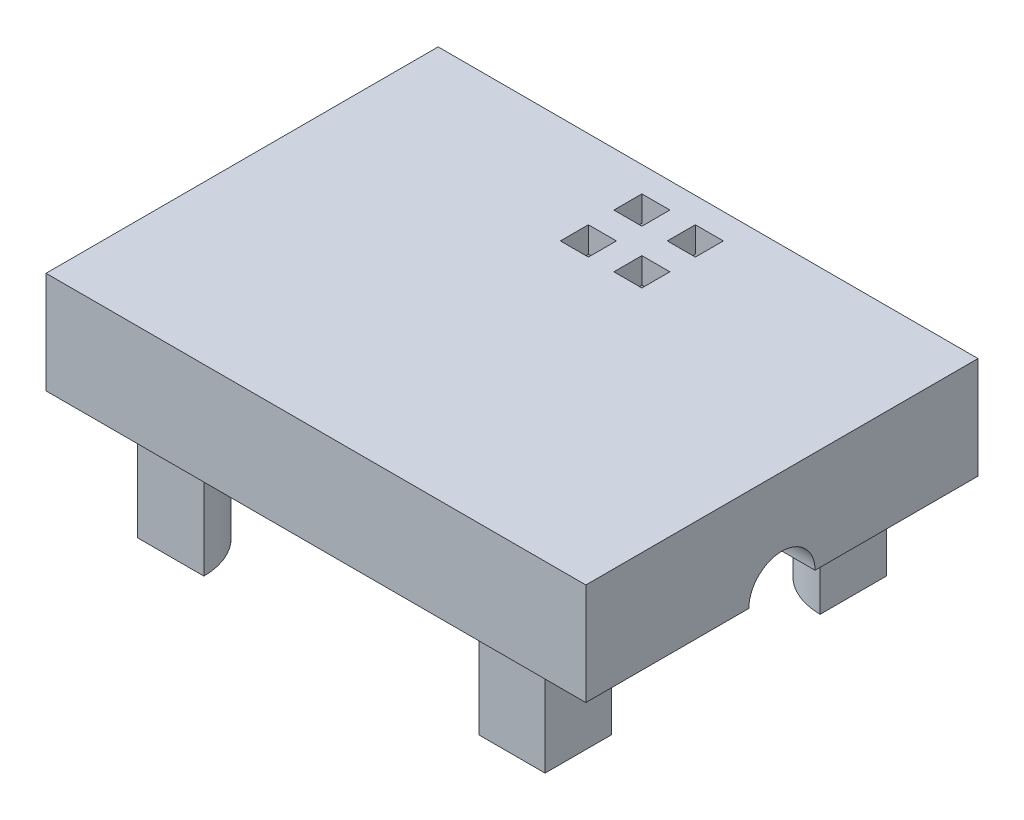
from build123d import *

# Parameters (mm, degrees)
CROQUIS1_W              = 42.4
CROQUIS1_H              = 30.8
CROQUIS1_W_2            = 32
CROQUIS1_H_2            = 26.8
SALIENTE_EXTRUIR1_DEPTH = 6
SALIENTE_EXTRUIR2_DEPTH = 14.4
SALIENTE_EXTRUIR3_START = 2
CROQUIS1_4_W            = 42.4
CROQUIS1_4_H            = 30.8
CROQUIS1_4_W_2          = 32
CROQUIS1_4_H_2          = 26.8
CROQUIS1_4_W_3          = 2.2
CROQUIS1_4_H_3          = 2.2
SALIENTE_EXTRUIR3_DEPTH = 2
CORTAR_EXTRUIR1_REACH   = 49.353


with BuildPart() as part:
    # Croquis1 → Saliente-Extruir1 (new body)
    with BuildSketch(Plane(origin=(0, 0, 0), x_dir=(1, 0, 0), z_dir=(0, 1, 0))):
        Rectangle(CROQUIS1_W, CROQUIS1_H)
        Rectangle(CROQUIS1_W_2, CROQUIS1_H_2, mode=Mode.SUBTRACT)
    extrude(amount=-SALIENTE_EXTRUIR1_DEPTH)

    # Croquis1<3> → Saliente-Extruir2 (add)
    with BuildSketch(Plane(origin=(0, 0, 0), x_dir=(1, 0, 0), z_dir=(0, 1, 0))):
        with BuildLine():
            Line((-16, 13.4), (-16, 8.2))
            ThreePointArc((-16, 8.2), (-12.323044738, 9.723044738), (-10.8, 13.4))
            Line((-10.8, 13.4), (-16, 13.4))
        make_face()
        with BuildLine():
            Line((-16, -8.2), (-16, -13.4))
            Line((-16, -13.4), (-10.8, -13.4))
            ThreePointArc((-10.8, -13.4), (-12.323044738, -9.723044738), (-16, -8.2))
        make_face()
        with BuildLine():
            ThreePointArc((10.8, 13.4), (12.323044738, 9.723044738), (16, 8.2))
            Line((16, 8.2), (16, 13.4))
            Line((16, 13.4), (10.8, 13.4))
        make_face()
        with BuildLine():
            ThreePointArc((16, -8.2), (12.323044738, -9.723044738), (10.8, -13.4))
            Line((10.8, -13.4), (16, -13.4))
            Line((16, -13.4), (16, -8.2))
        make_face()
    extrude(amount=-SALIENTE_EXTRUIR2_DEPTH)

    # Croquis1<4> → Saliente-Extruir3 (add)
    # profile 1 of 6: a face of its own
    with BuildSketch(Plane(origin=(0, 0, 0), x_dir=(1, 0, 0), z_dir=(0, 1, 0)).offset(SALIENTE_EXTRUIR3_START)):
        Rectangle(CROQUIS1_4_W, CROQUIS1_4_H)
        Rectangle(CROQUIS1_4_W_2, CROQUIS1_4_H_2, mode=Mode.SUBTRACT)
    # profile 2 of 6: a face of its own
    with BuildSketch(Plane(origin=(0, 0, 0), x_dir=(1, 0, 0), z_dir=(0, 1, 0)).offset(SALIENTE_EXTRUIR3_START)):
        with BuildLine():
            Line((-16, -8.2), (-16, -13.4))
            Line((-16, -13.4), (-10.8, -13.4))
            ThreePointArc((-10.8, -13.4), (-12.323044738, -9.723044738), (-16, -8.2))
        make_face()
    # profile 3 of 6: a face of its own
    with BuildSketch(Plane(origin=(0, 0, 0), x_dir=(1, 0, 0), z_dir=(0, 1, 0)).offset(SALIENTE_EXTRUIR3_START)):
        with BuildLine():
            ThreePointArc((16, -8.2), (12.323044738, -9.723044738), (10.8, -13.4))
            Line((10.8, -13.4), (16, -13.4))
            Line((16, -13.4), (16, -8.2))
        make_face()
    # profile 4 of 6: a face of its own
    with BuildSketch(Plane(origin=(0, 0, 0), x_dir=(1, 0, 0), z_dir=(0, 1, 0)).offset(SALIENTE_EXTRUIR3_START)):
        with BuildLine():
            ThreePointArc((10.8, 13.4), (12.323044738, 9.723044738), (16, 8.2))
            Line((16, 8.2), (16, 13.4))
            Line((16, 13.4), (10.8, 13.4))
        make_face()
    # profile 5 of 6: a face of its own
    with BuildSketch(Plane(origin=(0, 0, 0), x_dir=(1, 0, 0), z_dir=(0, 1, 0)).offset(SALIENTE_EXTRUIR3_START)):
        with BuildLine():
            Line((-16, 13.4), (-16, 8.2))
            ThreePointArc((-16, 8.2), (-12.323044738, 9.723044738), (-10.8, 13.4))
            Line((-10.8, 13.4), (-16, 13.4))
        make_face()
    # profile 6 of 6: a face of its own
    with BuildSketch(Plane(origin=(0, 0, 0), x_dir=(1, 0, 0), z_dir=(0, 1, 0)).offset(SALIENTE_EXTRUIR3_START)):
        with BuildLine():
            ThreePointArc((-16, -8.2), (-12.323044738, -9.723044738), (-10.8, -13.4))
            Line((-10.8, -13.4), (10.8, -13.4))
            ThreePointArc((10.8, -13.4), (12.323044738, -9.723044738), (16, -8.2))
            Line((16, -8.2), (16, 8.2))
            ThreePointArc((16, 8.2), (12.323044738, 9.723044738), (10.8, 13.4))
            Line((10.8, 13.4), (3.2, 13.4))
            Line((3.2, 13.4), (3.2, 11.2))
            Line((3.2, 11.2), (1, 11.2))
            Line((1, 11.2), (1, 13.4))
            Line((1, 13.4), (-1, 13.4))
            Line((-1, 13.4), (-1, 11.2))
            Line((-1, 11.2), (-3.2, 11.2))
            Line((-3.2, 11.2), (-3.2, 13.4))
            Line((-3.2, 13.4), (-10.8, 13.4))
            ThreePointArc((-10.8, 13.4), (-12.323044738, 9.723044738), (-16, 8.2))
            Line((-16, 8.2), (-16, -8.2))
        make_face()
        with Locations((-2.1, 8.1)):
            Rectangle(CROQUIS1_4_W_3, CROQUIS1_4_H_3, mode=Mode.SUBTRACT)
        with Locations((2.1, 8.1)):
            Rectangle(CROQUIS1_4_W_3, CROQUIS1_4_H_3, mode=Mode.SUBTRACT)
    extrude(amount=-SALIENTE_EXTRUIR3_DEPTH)

    # Cortar-Extruir1: up to this face of the body (flat: up to its plane)
    cortar_extruir1_end = Plane(part.part.faces().sort_by_distance((-21.2, -2, 0))[0])
    # Croquis2 → Cortar-Extruir1 (cut, up to the picked face)
    with BuildSketch(Plane(origin=(21.2, 0, 0), x_dir=(0, 0, -1), z_dir=(1, 0, 0)), mode=Mode.PRIVATE) as cortar_extruir1_sk1:
        with BuildLine():
            Line((-2.6, -6), (2.6, -6))
            ThreePointArc((2.6, -6), (0, -3.4), (-2.6, -6))
        make_face()
    cortar_extruir1_tool1 = split(extrude(cortar_extruir1_sk1.sketch, amount=-CORTAR_EXTRUIR1_REACH, mode=Mode.PRIVATE), bisect_by=cortar_extruir1_end, keep=Keep.BOTH, mode=Mode.PRIVATE)
    add(cortar_extruir1_tool1.solids().sort_by(Axis((21.2, -4.896526, 0), (-1, 0, 0)))[0], mode=Mode.SUBTRACT)


solid = part.part
